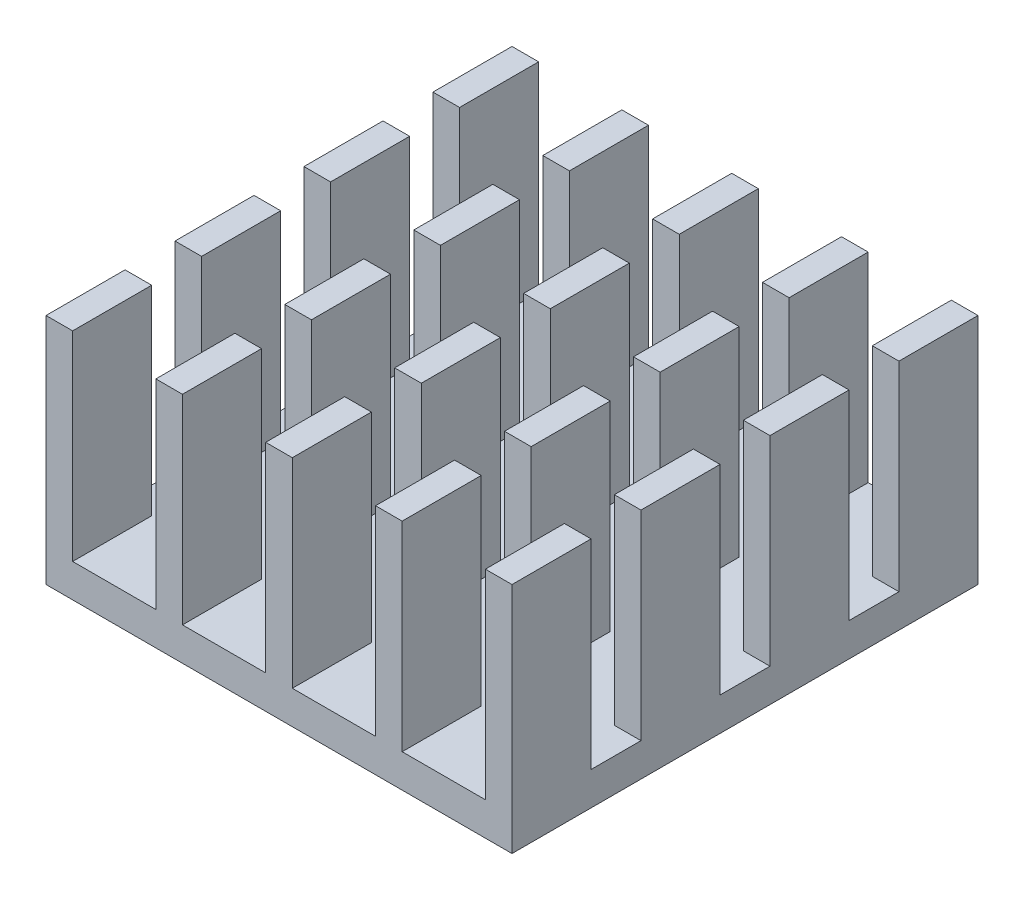
from build123d import *

# Parameters (mm, degrees)
BOSS_EXTRUDE1_DEPTH = 14
SKETCH2_W           = 1.5
SKETCH2_H           = 6
CUT_EXTRUDE1_DEPTH  = 22


with BuildPart() as part:
    # Sketch1 → Boss-Extrude1 (new body)
    with BuildSketch(Plane.XY):
        Polygon((-7, 0), (7, 0), (7, 7), (6.2, 7), (6.2, 1), (3.7, 1), (3.7, 7), (2.9, 7), (2.9, 1), (0.4, 1), (0.4, 7), (-0.4, 7), (-0.4, 1), (-2.9, 1), (-2.9, 7), (-3.7, 7), (-3.7, 1), (-6.2, 1), (-6.2, 7), (-7, 7), align=None)
    extrude(amount=BOSS_EXTRUDE1_DEPTH)

    # Sketch2 → Cut-Extrude1 (cut, through all)
    with BuildSketch(Plane.ZY.offset(7)):
        with Locations((3.125, 4)):
            Rectangle(SKETCH2_W, SKETCH2_H)
        with Locations((7, 4)):
            Rectangle(SKETCH2_W, SKETCH2_H)
        with Locations((10.875, 4)):
            Rectangle(SKETCH2_W, SKETCH2_H)
    extrude(amount=-CUT_EXTRUDE1_DEPTH, mode=Mode.SUBTRACT)


solid = part.part
